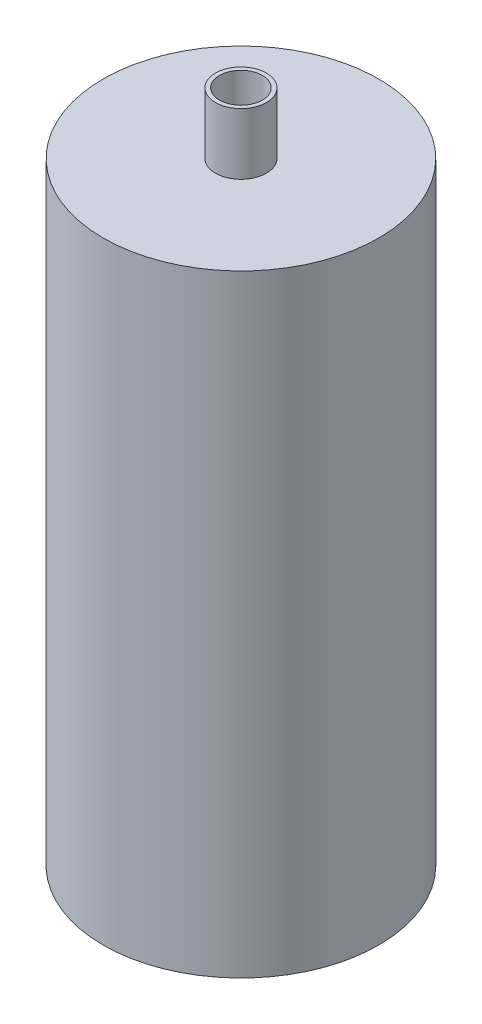
from build123d import *

# Parameters (mm, degrees)
SKETCH1_R           = 13.5
BOSS_EXTRUDE1_DEPTH = 60
SKETCH2_R           = 2.5
BOSS_EXTRUDE2_DEPTH = 6
SKETCH3_R           = 2.1
CUT_EXTRUDE1_DEPTH  = 69.705894944


with BuildPart() as part:
    # Sketch1 → Boss-Extrude1 (new body)
    with BuildSketch(Plane(origin=(0, 0, 0), x_dir=(1, 0, 0), z_dir=(0, 1, 0))):
        with Locations(Location((0, 0, 0), (0, 0, 270))):
            Circle(SKETCH1_R)
    extrude(amount=BOSS_EXTRUDE1_DEPTH)

    # Sketch2 → Boss-Extrude2 (add)
    with BuildSketch(Plane(origin=(0, 60, 0), x_dir=(1, 0, 0), z_dir=(0, 1, 0))):
        with Locations(Location((0, 0, 0), (0, 0, 270))):
            Circle(SKETCH2_R)
    extrude(amount=BOSS_EXTRUDE2_DEPTH)

    # Sketch3 → Cut-Extrude1 (cut, through all)
    with BuildSketch(Plane(origin=(0, 66, 0), x_dir=(1, 0, 0), z_dir=(0, 1, 0))):
        with Locations(Location((0, 0, 0), (0, 0, 270))):
            Circle(SKETCH3_R)
    extrude(amount=-CUT_EXTRUDE1_DEPTH, mode=Mode.SUBTRACT)


solid = part.part
